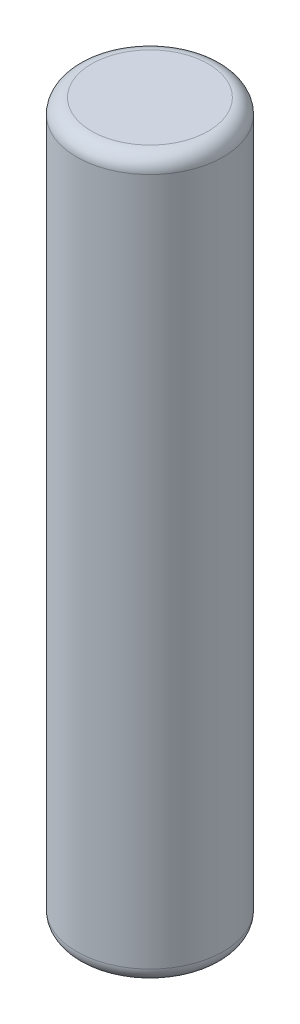
from build123d import *

# Parameters (mm, degrees)
SKETCH1_R           = 2.45
BOSS_EXTRUDE1_DEPTH = 24
FILLET1_R           = 0.5


with BuildPart() as part:
    # Sketch1 → Boss-Extrude1 (new body)
    with BuildSketch(Plane(origin=(0, 0, 0), x_dir=(1, 0, 0), z_dir=(0, 1, 0))):
        with Locations(Location((0, 0, 0), (0, 0, 270))):
            Circle(SKETCH1_R)
    extrude(amount=BOSS_EXTRUDE1_DEPTH)

    # Fillet1
    fillet1_edges = [part.edges().sort_by_distance(p)[0] for p in [
        (0, 0, -2.45),
        (0, 24, -2.45),
    ]]
    fillet(fillet1_edges, radius=FILLET1_R)


solid = part.part
